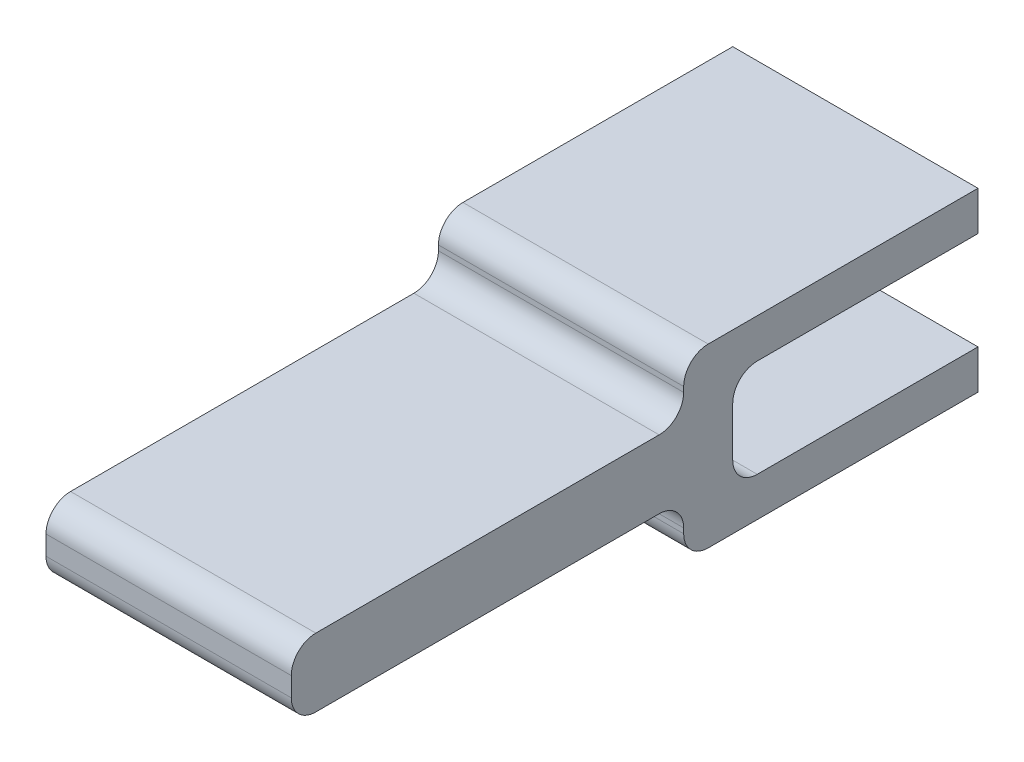
from build123d import *

# Parameters (mm, degrees)
SKETCH_1_W          = 6.6
SKETCH_1_H          = 3.6
SKETCH_1_W_2        = 5
SKETCH_1_H_2        = 2
EXTRUDE_1_DEPTH     = 5
CUT_EXTRUDE_2_REACH = 8.255
SKETCH_2_W          = 0.8
SKETCH_2_H          = 3.6
SKETCH_3_W          = 5
SKETCH_3_H          = 3.6
EXTRUDE_1_2_DEPTH   = 1
SKETCH_4_W          = 5
SKETCH_4_H          = 1.393036208
EXTRUDE_2_DEPTH     = 8
FILLET_1_R          = 0.5


with BuildPart() as part:
    # Эскиз1 → Extrude 1 (new body)
    with BuildSketch(Plane.XY):
        Rectangle(SKETCH_1_W, SKETCH_1_H)
        Rectangle(SKETCH_1_W_2, SKETCH_1_H_2, mode=Mode.SUBTRACT)
    extrude(amount=EXTRUDE_1_DEPTH)

    # Эскиз2 → Вырез-Вытянуть2 (cut, up to next)
    with BuildSketch(Plane.XY.offset(5), mode=Mode.PRIVATE) as cut_extrude_2_sk1:
        with Locations((-2.9, 0)):
            Rectangle(SKETCH_2_W, SKETCH_2_H)
    cut_extrude_2_tool1 = extrude(cut_extrude_2_sk1.sketch, amount=-CUT_EXTRUDE_2_REACH, mode=Mode.PRIVATE) & part.part
    # Эскиз2 → Вырез-Вытянуть2 (cut, up to next)
    with BuildSketch(Plane.XY.offset(5), mode=Mode.PRIVATE) as cut_extrude_2_sk2:
        with Locations((2.9, 0)):
            Rectangle(SKETCH_2_W, SKETCH_2_H)
    cut_extrude_2_tool2 = extrude(cut_extrude_2_sk2.sketch, amount=-CUT_EXTRUDE_2_REACH, mode=Mode.PRIVATE) & part.part
    add(cut_extrude_2_tool1.solids().sort_by_distance((-2.9, 0, 5))[0], mode=Mode.SUBTRACT)
    add(cut_extrude_2_tool2.solids().sort_by_distance((2.9, 0, 5))[0], mode=Mode.SUBTRACT)


with BuildPart() as cut_extrude_2_piece_1:
    # of the separate pieces the step leaves, piece 1, a body of its own (cut_extrude_2_pieces)
    add(part.part.solids().sort_by_distance((2.5, -1.8, 0))[0])



with BuildPart() as cut_extrude_2_piece_2:
    # of the separate pieces the step leaves, piece 2, a body of its own (cut_extrude_2_pieces)
    add(part.part.solids().sort_by_distance((-2.5, 1.8, 0))[0])


with BuildPart() as cut_extrude_2_piece_1_1:
    add(cut_extrude_2_piece_1.part)

    add(cut_extrude_2_piece_2.part)  # Extrude 1 2 merges Вырез-Вытянуть2 piece 2
    # Эскиз3 → Extrude 1 2 (add)
    with BuildSketch(Plane.XY.offset(5)):
        Rectangle(SKETCH_3_W, SKETCH_3_H)
    extrude(amount=EXTRUDE_1_2_DEPTH)

    # Эскиз4 → Бобышка-Вытянуть2 (add)
    with BuildSketch(Plane.XY.offset(6)):
        Rectangle(SKETCH_4_W, SKETCH_4_H)
    extrude(amount=EXTRUDE_2_DEPTH)

    # Скругление1
    fillet_1_edges = [cut_extrude_2_piece_1_1.edges().sort_by_distance(p)[0] for p in [
        (0, -1.8, 6),
        (0, 1.8, 6),
        (0, 1, 5),
        (0, -1, 5),
        (0, 0.696518104, 6),
        (0, -0.696518104, 6),
        (0, 0.696518104, 14),
        (0, -0.696518104, 14),
    ]]
    fillet(fillet_1_edges, radius=FILLET_1_R)


solid = cut_extrude_2_piece_1_1.part
